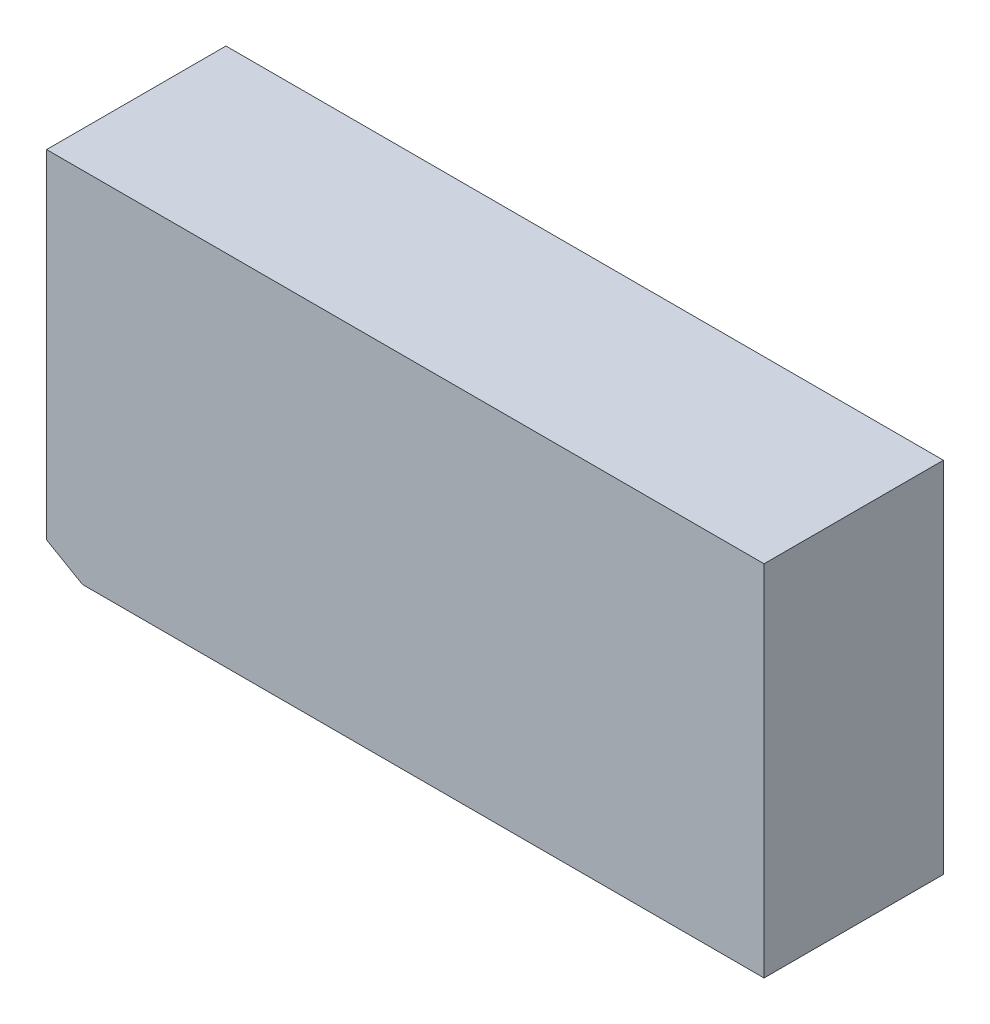
from build123d import *

# Parameters (mm, degrees)
SKETCH1_W           = 40
SKETCH1_H           = 20
BOSS_EXTRUDE1_DEPTH = 10
CHAMFER1_SIZE       = 1.154700538
CHAMFER1_SIZE2      = 2


with BuildPart() as part:
    # Sketch1 → Boss-Extrude1 (new body)
    with BuildSketch(Plane.XY):
        with Locations((20, 10)):
            Rectangle(SKETCH1_W, SKETCH1_H)
    extrude(amount=BOSS_EXTRUDE1_DEPTH)

    # Chamfer1
    chamfer1_edges = [part.edges().sort_by_distance(p)[0] for p in [
        (0, 0, 5),
    ]]
    chamfer1_side = [part.faces().sort_by_distance(p)[0] for p in [
        (0, 10, 5),
    ]]
    chamfer(chamfer1_edges, length=CHAMFER1_SIZE, length2=CHAMFER1_SIZE2, reference=chamfer1_side[0])


solid = part.part
